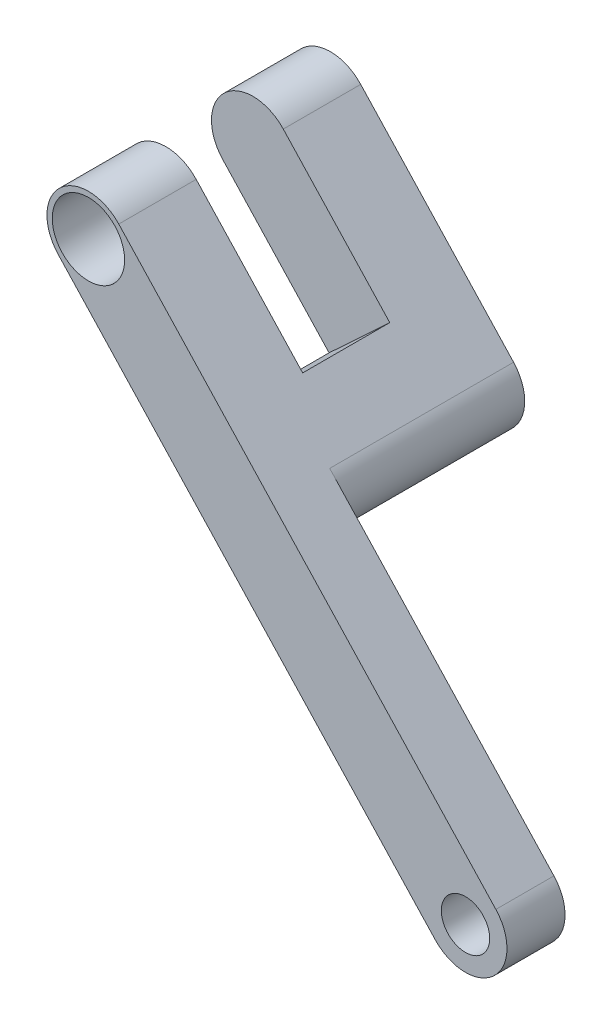
from build123d import *

# Parameters (mm, degrees)
SKETCH1_R           = 1.869394483
BOSS_EXTRUDE1_DEPTH = 4
BOSS_EXTRUDE2_START = 4.5
BOSS_EXTRUDE2_DEPTH = 4.5
BOSS_EXTRUDE3_START = 4
BOSS_EXTRUDE3_DEPTH = 4
BOSS_EXTRUDE4_START = -3
SKETCH6_R           = 1.25
BOSS_EXTRUDE4_DEPTH = 3


with BuildPart() as part:
    # Sketch1 → Boss-Extrude1 (new body)
    with BuildSketch(Plane.XY):
        with BuildLine():
            Line((21.403000099, -27.721654021), (29.301617843, -36.205200538))
            ThreePointArc((29.301617843, -36.205200538), (29.193506427, -39.233088823), (26.165618141, -39.124977407))
            Line((26.165618141, -39.124977407), (18.267000397, -30.64143089))
            ThreePointArc((18.267000397, -30.64143089), (18.375111813, -27.613542605), (21.403000099, -27.721654021))
        make_face()
        with Locations((19.835000248, -29.181542456)):
            Circle(SKETCH1_R, mode=Mode.SUBTRACT)
    extrude(amount=BOSS_EXTRUDE1_DEPTH)

    # Sketch2 → Boss-Extrude2 (add)
    with BuildSketch(Plane(origin=(0, 0, 0), x_dir=(-1, 0, 0), z_dir=(0, 0, -1)).offset(BOSS_EXTRUDE2_START)):
        with BuildLine():
            Line((-29.301617843, -36.205200538), (-26.904832103, -33.63092185))
            Line((-26.904832103, -33.63092185), (-23.768832401, -36.55069872))
            Line((-23.768832401, -36.55069872), (-26.165618141, -39.124977407))
            ThreePointArc((-26.165618141, -39.124977407), (-29.193506427, -39.233088823), (-29.301617843, -36.205200538))
        make_face()
    extrude(amount=-BOSS_EXTRUDE2_DEPTH)

    # Sketch3 → Boss-Extrude3 (add)
    with BuildSketch(Plane(origin=(0, 0, -4.5), x_dir=(-1, 0, 0), z_dir=(0, 0, -1)).offset(BOSS_EXTRUDE3_START)):
        with BuildLine():
            Line((-26.165618141, -39.124977407), (-23.768832401, -36.55069872))
            Line((-23.768832401, -36.55069872), (-18.267000397, -30.64143089))
            ThreePointArc((-18.267000397, -30.64143089), (-18.375111813, -27.613542605), (-21.403000099, -27.721654021))
            Line((-21.403000099, -27.721654021), (-26.904832103, -33.63092185))
            Line((-26.904832103, -33.63092185), (-29.301617843, -36.205200538))
            ThreePointArc((-29.301617843, -36.205200538), (-29.193506427, -39.233088823), (-26.165618141, -39.124977407))
        make_face()
    extrude(amount=-BOSS_EXTRUDE3_DEPTH)

    # Sketch6 → Boss-Extrude4 (add)
    with BuildSketch(Plane.XY.offset(4).offset(BOSS_EXTRUDE4_START)):
        with BuildLine():
            Line((37.749845774, -51.567070083), (26.165618141, -39.124977407))
            ThreePointArc((26.165618141, -39.124977407), (26.273729557, -36.097089122), (29.301617843, -36.205200538))
            Line((29.301617843, -36.205200538), (40.885845475, -48.647293214))
            ThreePointArc((40.885845475, -48.647293214), (40.777734059, -51.675181499), (37.749845774, -51.567070083))
        make_face()
        with Locations((39.317845624, -50.107181648)):
            Circle(SKETCH6_R, mode=Mode.SUBTRACT)
    extrude(amount=BOSS_EXTRUDE4_DEPTH)


solid = part.part
